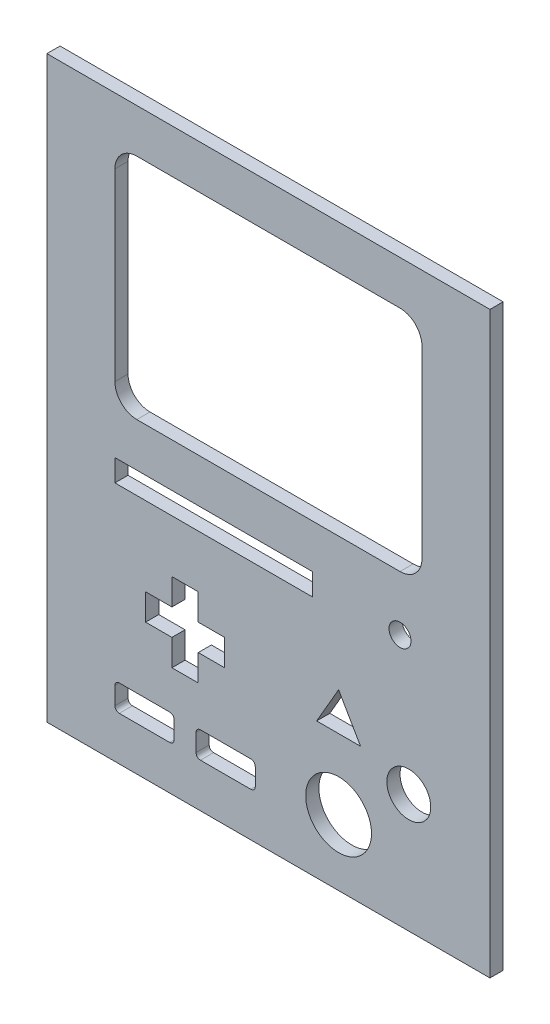
from build123d import *

# Parameters (mm, degrees)
SKETCH1_W           = 101
SKETCH1_H           = 132
BOSS_EXTRUDE1_DEPTH = 1.5
SKETCH2_R           = 7.5
SKETCH2_R_2         = 5
SKETCH2_R_3         = 2.5
SKETCH2_W           = 45
SKETCH2_H           = 5
CUT_EXTRUDE2_DEPTH  = 84.157982179


with BuildPart() as part:
    # Sketch1 → Boss-Extrude1 (new, symmetric)
    with BuildSketch(Plane.XY):
        Rectangle(SKETCH1_W, SKETCH1_H)
    extrude(amount=BOSS_EXTRUDE1_DEPTH, both=True)

    # Sketch2 → Cut-Extrude2 (cut, through all)
    with BuildSketch(Plane.XY.offset(1.5)):
        with Locations((16, -51)):
            Circle(SKETCH2_R)
        with Locations((32, -39)):
            Circle(SKETCH2_R_2)
        with Locations((30, -8.5)):
            Circle(SKETCH2_R_3)
        with BuildLine():
            Line((-30, 4), (30, 4))
            ThreePointArc((30, 4), (33.535533906, 5.464466094), (35, 9))
            Line((35, 9), (35, 51))
            ThreePointArc((35, 51), (33.535533906, 54.535533906), (30, 56))
            Line((30, 56), (-30, 56))
            ThreePointArc((-30, 56), (-33.535533906, 54.535533906), (-35, 51))
            Line((-35, 51), (-35, 9))
            ThreePointArc((-35, 9), (-33.535533906, 5.464466094), (-30, 4))
        make_face()
        Polygon((11, -35), (21, -35), (16, -26.339745962), align=None)
        with BuildLine():
            Line((-15.5, -56), (-4, -56))
            ThreePointArc((-4, -56), (-3.292893219, -55.707106781), (-3, -55))
            Line((-3, -55), (-3, -51))
            ThreePointArc((-3, -51), (-3.292893219, -50.292893219), (-4, -50))
            Line((-4, -50), (-15.5, -50))
            ThreePointArc((-15.5, -50), (-16.207106781, -50.292893219), (-16.5, -51))
            Line((-16.5, -51), (-16.5, -55))
            ThreePointArc((-16.5, -55), (-16.207106781, -55.707106781), (-15.5, -56))
        make_face()
        with BuildLine():
            Line((-34, -56), (-22.5, -56))
            ThreePointArc((-22.5, -56), (-21.792893219, -55.707106781), (-21.5, -55))
            Line((-21.5, -55), (-21.5, -51))
            ThreePointArc((-21.5, -51), (-21.792893219, -50.292893219), (-22.5, -50))
            Line((-22.5, -50), (-34, -50))
            ThreePointArc((-34, -50), (-34.707106781, -50.292893219), (-35, -51))
            Line((-35, -51), (-35, -55))
            ThreePointArc((-35, -55), (-34.707106781, -55.707106781), (-34, -56))
        make_face()
        Polygon((-22, -41), (-16, -41), (-16, -35), (-10, -35), (-10, -29), (-16, -29), (-16, -23), (-22, -23), (-22, -29), (-28, -29), (-28, -35), (-22, -35), align=None)
        with Locations((-12.5, -8.5)):
            Rectangle(SKETCH2_W, SKETCH2_H)
    extrude(amount=-CUT_EXTRUDE2_DEPTH, mode=Mode.SUBTRACT)


solid = part.part
